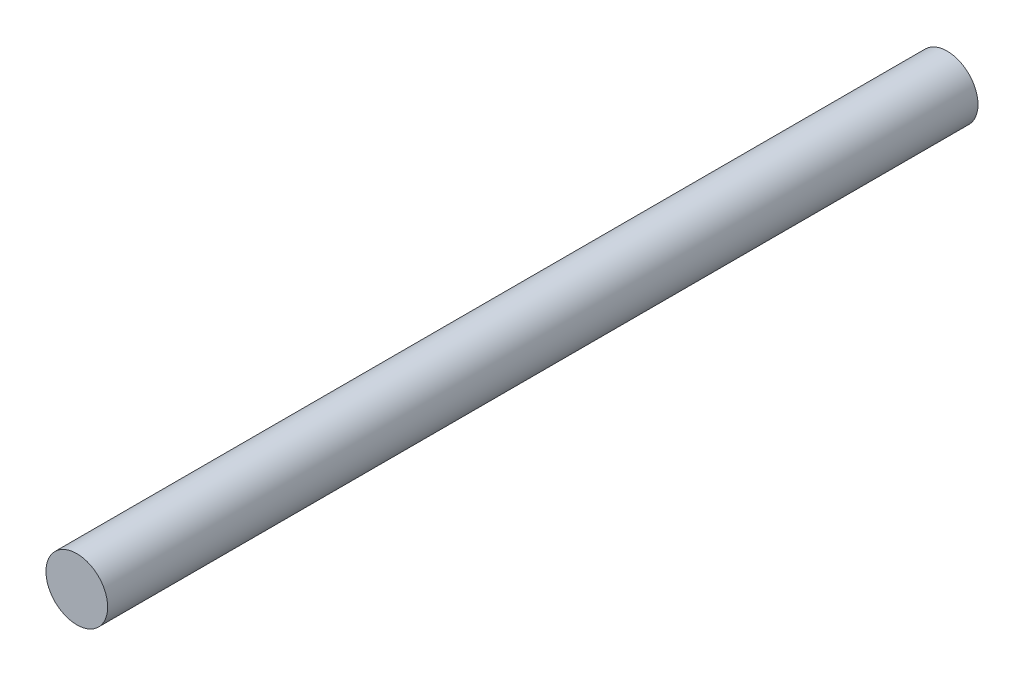
from build123d import *

# Parameters (mm, degrees)
ESQUISSE1_R        = 5
BOSS_EXTRU_1_DEPTH = 141


with BuildPart() as part:
    # Esquisse1 → Boss.-Extru.1 (new body)
    with BuildSketch(Plane.XY):
        Circle(ESQUISSE1_R)
    extrude(amount=BOSS_EXTRU_1_DEPTH)


solid = part.part
